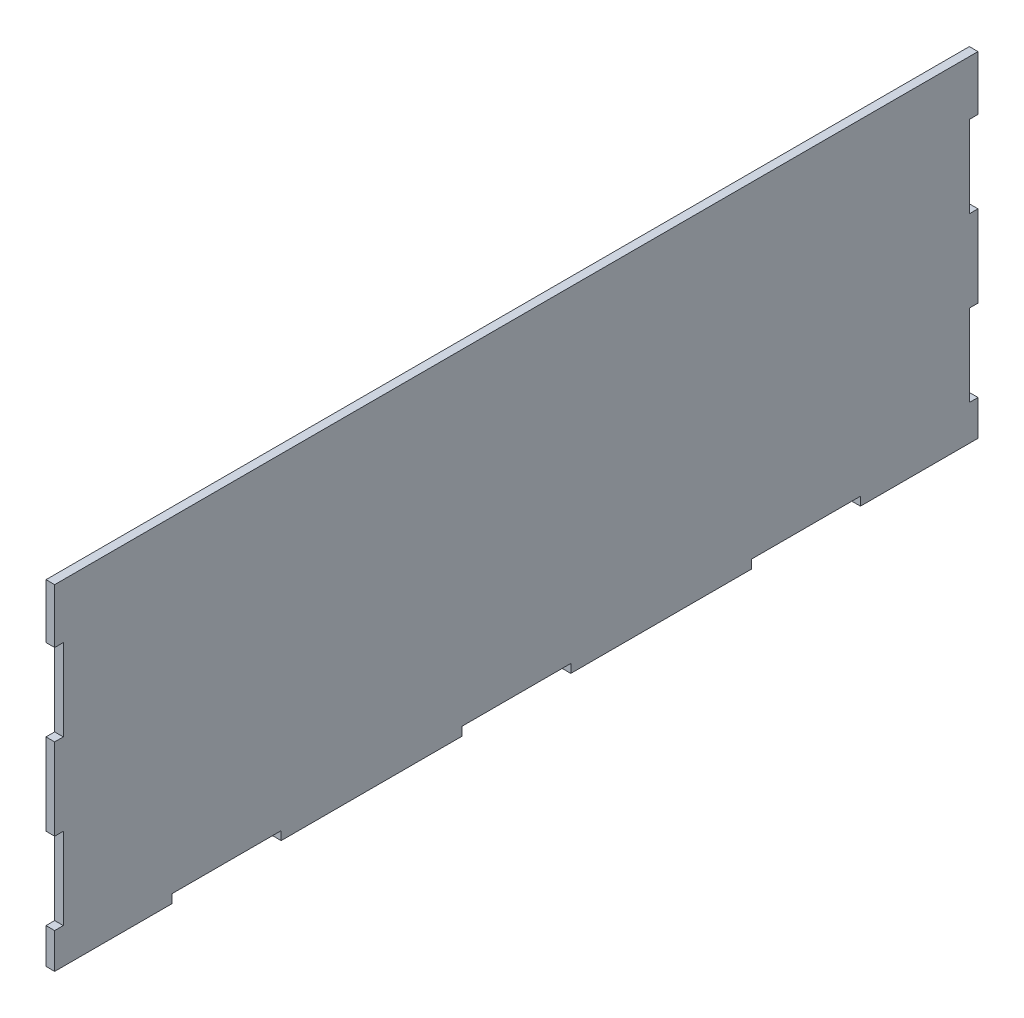
from build123d import *

# Parameters (mm, degrees)
SKETCH1_W           = 339.05
SKETCH1_H           = 123
BOSS_EXTRUDE1_DEPTH = 3.175
SKETCH2_W           = 3.175
SKETCH2_H           = 30
CUT_EXTRUDE1_DEPTH  = 10
SKETCH3_W           = 40
SKETCH3_H           = 3.175
CUT_EXTRUDE2_DEPTH  = 361.685435144
LPATTERN1_COUNT     = 3
LPATTERN1_PITCH     = 106.35


with BuildPart() as part:
    # Sketch1 → Boss-Extrude1 (new body)
    with BuildSketch(Plane(origin=(0, 0, 0), x_dir=(0, 0, -1), z_dir=(1, 0, 0))):
        with Locations((169.525, -61.5)):
            Rectangle(SKETCH1_W, SKETCH1_H)
    extrude(amount=BOSS_EXTRUDE1_DEPTH)

    # Sketch2 → Cut-Extrude1 (cut)
    with BuildSketch(Plane(origin=(3.175, 0, 0), x_dir=(0, 0, -1), z_dir=(1, 0, 0))):
        with Locations((337.4625, -35)):
            Rectangle(SKETCH2_W, SKETCH2_H)
        with Locations((337.4625, -95)):
            Rectangle(SKETCH2_W, SKETCH2_H)
        with Locations((1.5875, -35)):
            Rectangle(SKETCH2_W, SKETCH2_H)
        with Locations((1.5875, -95)):
            Rectangle(SKETCH2_W, SKETCH2_H)
    extrude(amount=-CUT_EXTRUDE1_DEPTH, mode=Mode.SUBTRACT)

    # Sketch3 → Cut-Extrude2 (cut, through all)
    with BuildSketch(Plane(origin=(3.175, 0, 0), x_dir=(0, 0, -1), z_dir=(1, 0, 0))):
        with Locations((63.18, -121.4125)):
            Rectangle(SKETCH3_W, SKETCH3_H)
    cut_extrude2 = extrude(amount=-CUT_EXTRUDE2_DEPTH, mode=Mode.SUBTRACT)

    # LPattern1: Cut-Extrude2 ×3
    with Locations(*[(0, 0, -i * LPATTERN1_PITCH) for i in range(1, LPATTERN1_COUNT)]):
        add(cut_extrude2, mode=Mode.SUBTRACT)


solid = part.part
